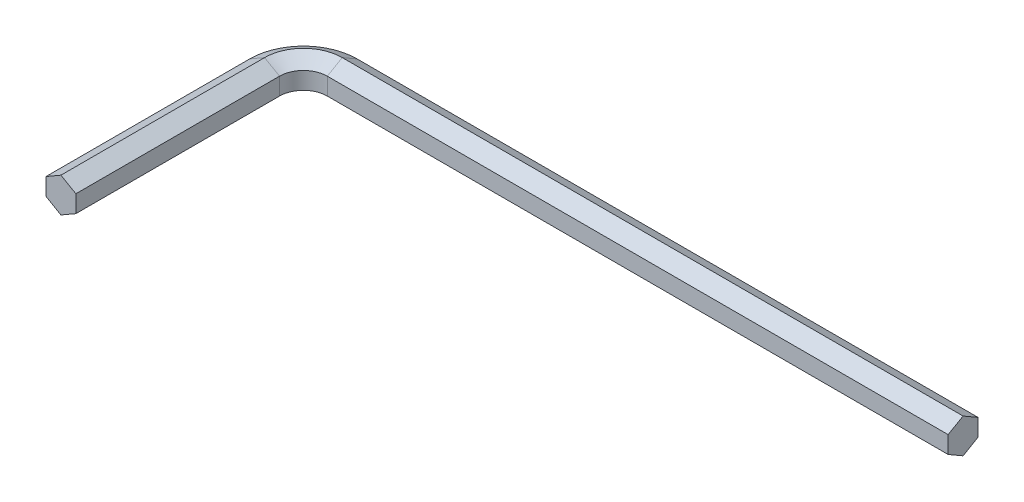
from build123d import *


with BuildPart() as part:
    # Sweep1: sweep along a path in Sketch1
    with BuildLine(Plane(origin=(0, 0, 0), x_dir=(1, 0, 0), z_dir=(0, 1, 0))) as sweep1_path:
        Line((0, 0), (-51.975, 0))
        ThreePointArc((-51.975, 0), (-53.389213562, -0.585786438), (-53.975, -2))
        Line((-53.975, -2), (-53.975, -19.05))
    # Sketch2 → Sweep1 (sweep)
    with BuildSketch(Plane(origin=(0, 0, 0), x_dir=(0, 0, -1), z_dir=(1, 0, 0))):
        Polygon((1.25, -0.721687836), (2.5, 0), (2.5, 1.443375673), (1.25, 2.165063509), (0, 1.443375673), (0, 0), align=None)
    sweep(path=sweep1_path.line)


solid = part.part
